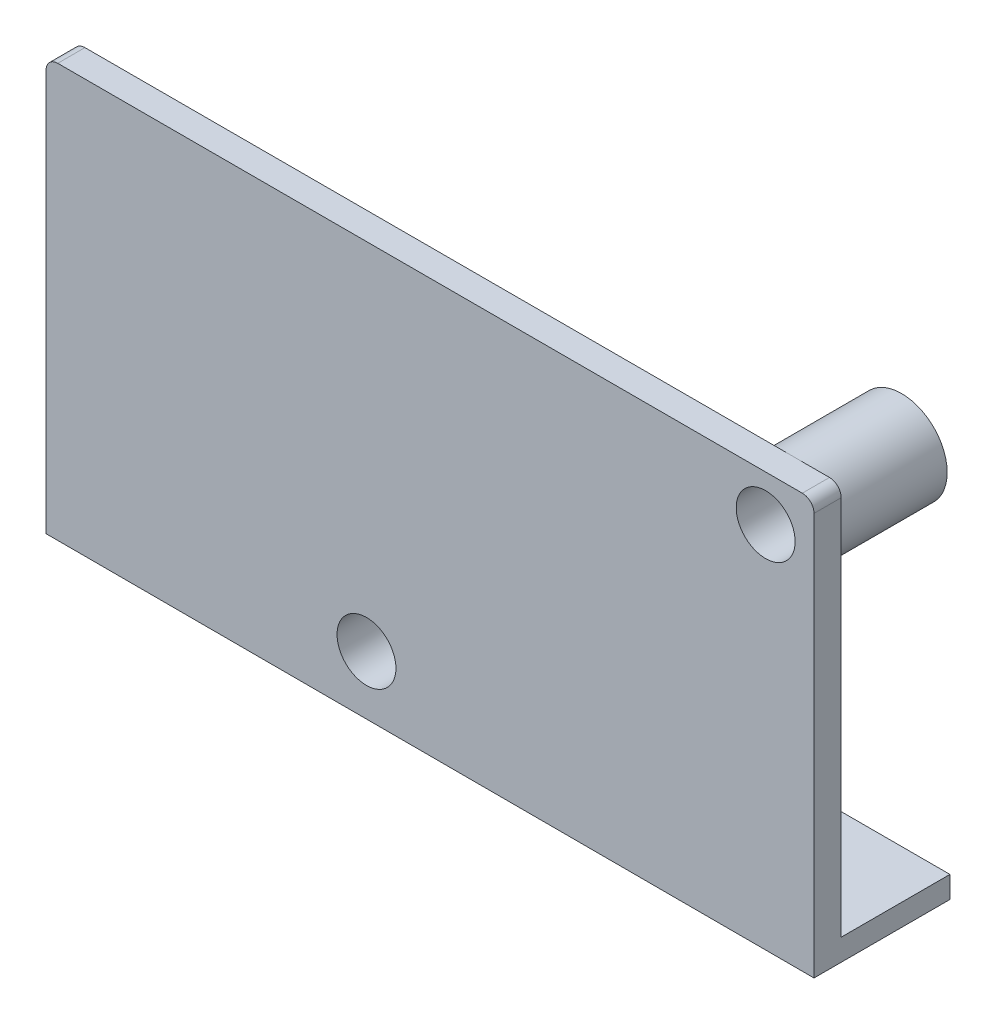
from build123d import *

# Parameters (mm, degrees)
EXTRUDE_1_DEPTH          = 2.5
SKETCH_4_W               = 70.612
SKETCH_4_H               = 2
EXTRUDE_2_DEPTH          = 10
SKETCH_5_R               = 4.19
SKETCH_5_R_2             = 4.191
EXTRUDE_3_DEPTH          = 12.5
SKETCH_7_R               = 2.7083489
SKETCH_7_R_2             = 2.708349387
CUT_EXTRUDE_1_DEPTH      = 10.5
CUT_EXTRUDE_2_DEPTH      = 48.585689944
CUT_EXTRUDE_2_DEPTH_BACK = 48.585689944
SKETCH_8_R               = 1.65


with BuildPart() as part:
    # 草图3 → 凸台-拉伸1 (new body)
    with BuildSketch(Plane.XY):
        with BuildLine():
            Line((-36.295196216, 26.676238556), (32.166947784, 26.676238556))
            ThreePointArc((32.166947784, 26.676238556), (32.927036662, 26.361399434), (33.241875784, 25.601310556))
            Line((33.241875784, 25.601310556), (33.241875784, -11.394297444))
            Line((33.241875784, -11.394297444), (-37.370124216, -11.320561244))
            Line((-37.370124216, -11.320561244), (-37.370124216, 25.601297856))
            ThreePointArc((-37.370124216, 25.601297856), (-37.055289584, 26.361394944), (-36.295196216, 26.676238556))
        make_face()
    extrude(amount=-EXTRUDE_1_DEPTH)

    # 草图4 → 凸台-拉伸2 (add)
    with BuildSketch(Plane(origin=(0, 0, -2.5), x_dir=(-1, 0, 0), z_dir=(0, 0, -1))):
        with Locations((2.064124216, -10.394297444)):
            Rectangle(SKETCH_4_W, SKETCH_4_H)
    extrude(amount=EXTRUDE_2_DEPTH)

    # 草图5 → 凸台-拉伸3 (add)
    with BuildSketch(Plane.XY):
        with Locations((-7.906124216, -5.962761444)):
            Circle(SKETCH_5_R)
        with Locations((28.796875784, 22.485238556)):
            Circle(SKETCH_5_R_2)
    extrude(amount=-EXTRUDE_3_DEPTH)

    # 草图7 → 切除-拉伸1 (cut)
    with BuildSketch(Plane.XY):
        with Locations((-7.906124216, -5.962761444)):
            Circle(SKETCH_7_R)
        with Locations((28.796875784, 22.485238556)):
            Circle(SKETCH_7_R_2)
    extrude(amount=-CUT_EXTRUDE_1_DEPTH, mode=Mode.SUBTRACT)

    # 草图8 → 切除-拉伸2 (cut, two sides: drawn at the far end of the back side and taken through both)
    with BuildSketch(Plane(origin=(0, 0, -12.5), x_dir=(-1, 0, 0), z_dir=(0, 0, -1)).offset(-CUT_EXTRUDE_2_DEPTH_BACK)):
        with Locations(Location((-28.796875784, 22.485238556, 0), (0, 0, 180))):
            Circle(SKETCH_8_R)
        with Locations(Location((7.906124216, -5.962761444, 0), (0, 0, 180))):
            Circle(SKETCH_8_R)
    extrude(amount=CUT_EXTRUDE_2_DEPTH + CUT_EXTRUDE_2_DEPTH_BACK, mode=Mode.SUBTRACT)


solid = part.part
